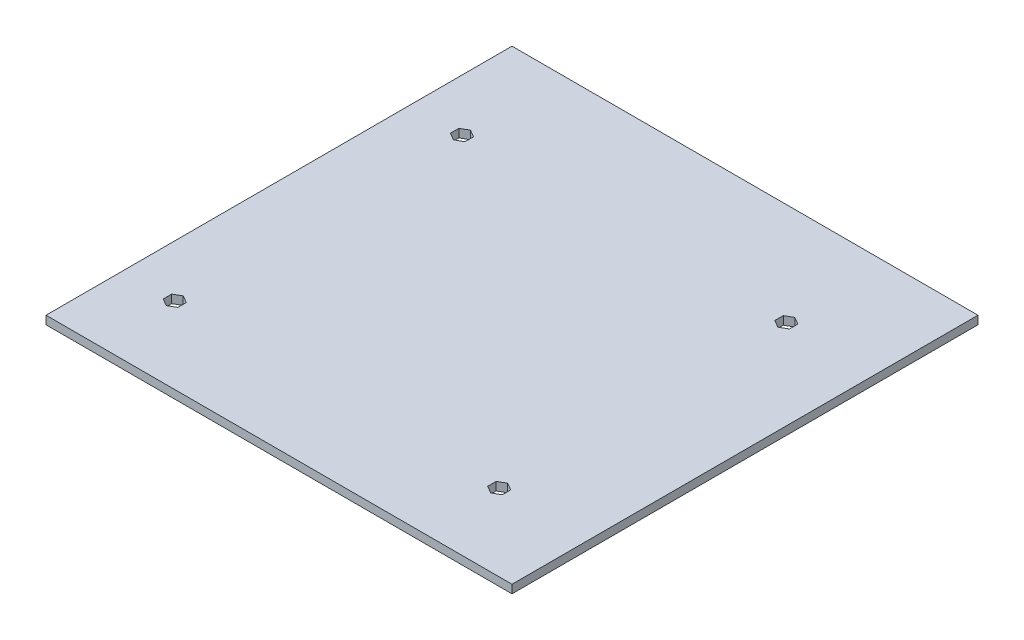
from build123d import *

# Parameters (mm, degrees)
SKETCH1_W           = 177.8
SKETCH1_H           = 177.8
BOSS_EXTRUDE1_DEPTH = 3.175
CUT_EXTRUDE1_DEPTH  = 3.175


with BuildPart() as part:
    # Sketch1 → Boss-Extrude1 (new body)
    with BuildSketch(Plane(origin=(0, 0, 0), x_dir=(1, 0, 0), z_dir=(0, 1, 0))):
        with Locations((12.927293065, -21.876957494)):
            Rectangle(SKETCH1_W, SKETCH1_H)
    extrude(amount=BOSS_EXTRUDE1_DEPTH)

    # Sketch2 → Cut-Extrude1 (cut)
    with BuildSketch(Plane(origin=(0, 3.175, 0), x_dir=(1, 0, 0), z_dir=(0, 1, 0))):
        Polygon((-58.933539099, 29.756107449), (-58.964226854, 26.530020098), (-56.185697131, 24.890400047), (-53.376479653, 26.476867346), (-53.345791898, 29.702954697), (-56.12432162, 31.342574748), align=None)
        Polygon((67.610456963, 31.342611237), (64.816456963, 29.729494584), (64.816456963, 26.50326128), (67.610456963, 24.890144628), (70.404456963, 26.50326128), (70.404456963, 29.729494584), align=None)
        Polygon((-56.185697131, -78.214493702), (-58.979697131, -79.827610354), (-58.979697131, -83.053843659), (-56.185697131, -84.666960311), (-53.391697131, -83.053843659), (-53.391697131, -79.827610354), align=None)
        Polygon((67.610393763, -78.214493702), (64.816393763, -79.827610354), (64.816393763, -83.053843659), (67.610393763, -84.666960311), (70.404393763, -83.053843659), (70.404393763, -79.827610354), align=None)
    extrude(amount=-CUT_EXTRUDE1_DEPTH, mode=Mode.SUBTRACT)


solid = part.part
